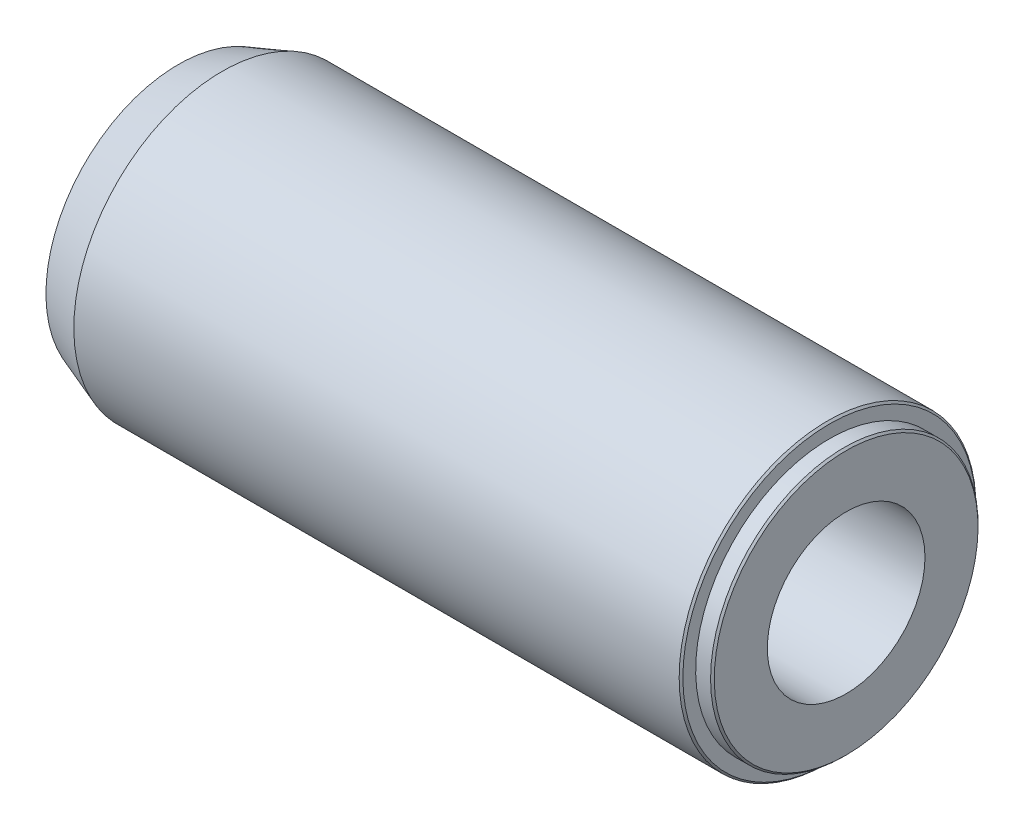
from build123d import *

# Parameters (mm, degrees)
CORTAR_EXTRUIR1_DEPTH      = 5
CHAFL_N1_SIZE              = 0.1
TALADRO_ROSCADO_M101_D     = 8.5
TALADRO_ROSCADO_M101_DEPTH = 25
TALADRO_ROSCADO_M101_TIP   = 2.553657631


with BuildPart() as part:
    # Sketch1 → Revolve1 (revolve)
    with BuildSketch(Plane.XY, mode=Mode.PRIVATE) as revolve1_sk:
        Polygon((-3, 7.99722512), (-35.734329665, 7.99722512), (-38.096725725, 7.137383273), (-38.096725725, -0.00277488), (-2.096725725, -0.00277488), (-2.096725725, 7.2074675), (-3, 7.2074675), align=None)
    revolve(revolve1_sk.sketch.rotate(Axis((-38.096725725, -0.00277488, 0), (1, 0, 0)), 180), axis=Axis((-38.096725725, -0.00277488, 0), (1, 0, 0)))

    # Croquis3 → Cortar-Extruir1 (cut)
    with BuildSketch(Plane.ZY.offset(38.096725725)):
        Polygon((0, -3.156760752), (2.733835005, -1.578380376), (2.733835005, 1.578380376), (0, 3.156760752), (-2.733835005, 1.578380376), (-2.733835005, -1.578380376), align=None)
    extrude(amount=-CORTAR_EXTRUIR1_DEPTH, mode=Mode.SUBTRACT)

    # Chaflán1
    chafl_n1_edges = [part.edges().sort_by_distance(p)[0] for p in [
        (-2.096725725, 7.2074675, 0),
        (-3, 7.99722512, 0),
    ]]
    chamfer(chafl_n1_edges, length=CHAFL_N1_SIZE)

    # Taladro roscado M101
    with Locations(Plane(origin=(-2.096725725, 0, 0), x_dir=(0, 0, -1), z_dir=(1, 0, 0))):
        with Locations((0, 0)):
            Hole(TALADRO_ROSCADO_M101_D / 2, depth=TALADRO_ROSCADO_M101_DEPTH)
            with Locations((0, 0, -(TALADRO_ROSCADO_M101_DEPTH + TALADRO_ROSCADO_M101_TIP / 2))):  # 118° drill point
                Cone(0, TALADRO_ROSCADO_M101_D / 2, TALADRO_ROSCADO_M101_TIP, mode=Mode.SUBTRACT)


solid = part.part
